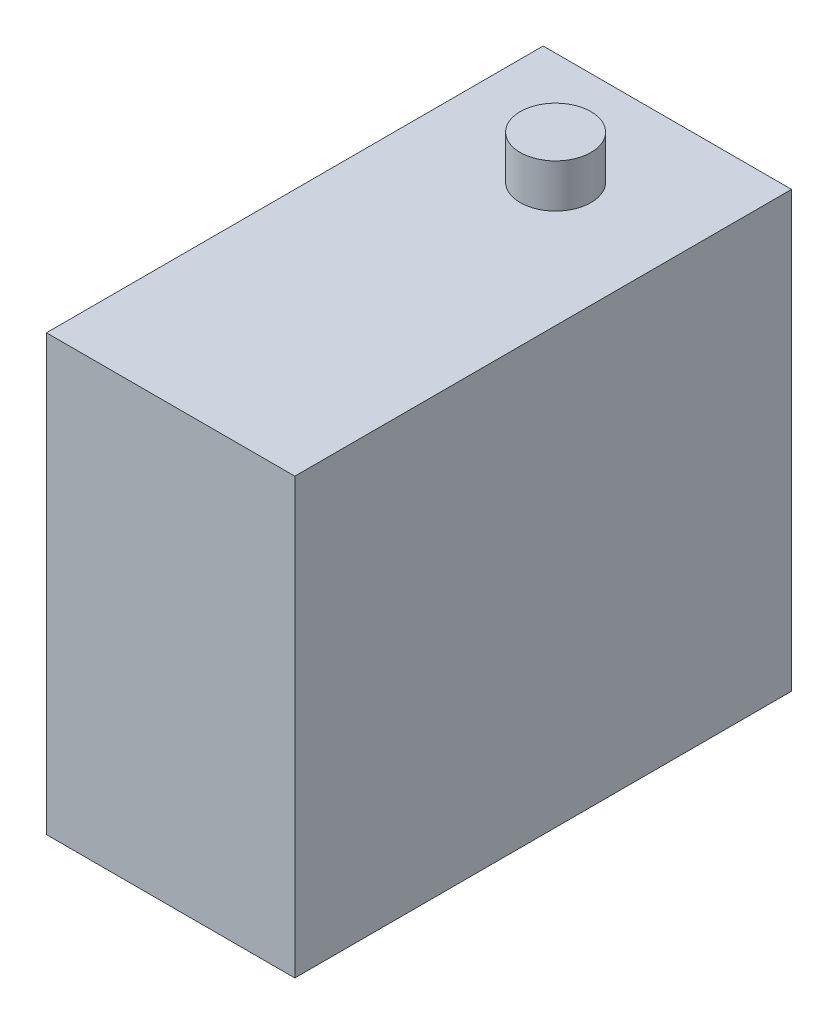
from build123d import *

# Parameters (mm, degrees)
SKETCH2_W           = 20
SKETCH2_H           = 40
BOSS_EXTRUDE1_DEPTH = 35
SKETCH3_R           = 2.85
BOSS_EXTRUDE2_DEPTH = 3.5


with BuildPart() as part:
    # Sketch2 → Boss-Extrude1 (new body)
    with BuildSketch(Plane(origin=(0, 0, 0), x_dir=(1, 0, 0), z_dir=(0, 1, 0))):
        Rectangle(SKETCH2_W, SKETCH2_H)
    extrude(amount=BOSS_EXTRUDE1_DEPTH)

    # Sketch3 → Boss-Extrude2 (add)
    with BuildSketch(Plane(origin=(0, 35, 0), x_dir=(1, 0, 0), z_dir=(0, 1, 0))):
        with Locations(Location((0, 11, 0), (0, 0, 90))):
            Circle(SKETCH3_R)
    extrude(amount=BOSS_EXTRUDE2_DEPTH)


solid = part.part
